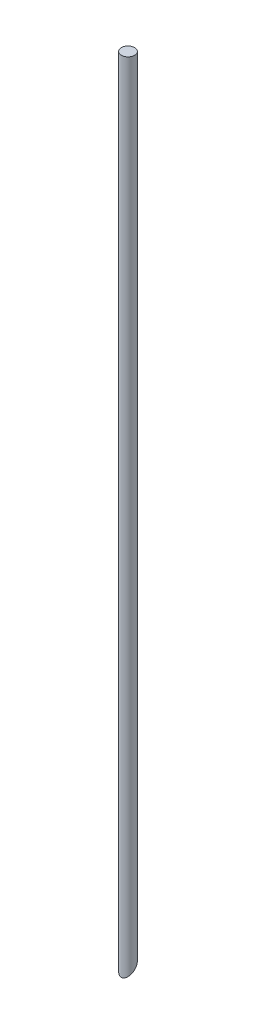
from build123d import *

# Parameters (mm, degrees)
SKETCH_1_R               = 5
EXTRUDE_1_DEPTH          = 600
CUT_EXTRUDE_1_DEPTH      = 601.04166522
CUT_EXTRUDE_1_DEPTH_BACK = 601.04166522


with BuildPart() as part:
    # 草图1 → 凸台-拉伸1 (new body)
    with BuildSketch(Plane(origin=(0, 0, 0), x_dir=(1, 0, 0), z_dir=(0, 1, 0))):
        with Locations(Location((0, 0, 0), (0, 0, 270))):
            Circle(SKETCH_1_R)
    extrude(amount=EXTRUDE_1_DEPTH)

    # 草图2 → 切除-拉伸1 (cut, two sides: drawn at the far end of the back side and taken through both)
    with BuildSketch(Plane(origin=(0, 0, 0), x_dir=(0, 0, -1), z_dir=(1, 0, 0)).offset(-CUT_EXTRUDE_1_DEPTH_BACK)):
        Polygon((-5, 0), (5, 10), (5, 0), align=None)
    extrude(amount=CUT_EXTRUDE_1_DEPTH + CUT_EXTRUDE_1_DEPTH_BACK, mode=Mode.SUBTRACT)


solid = part.part
